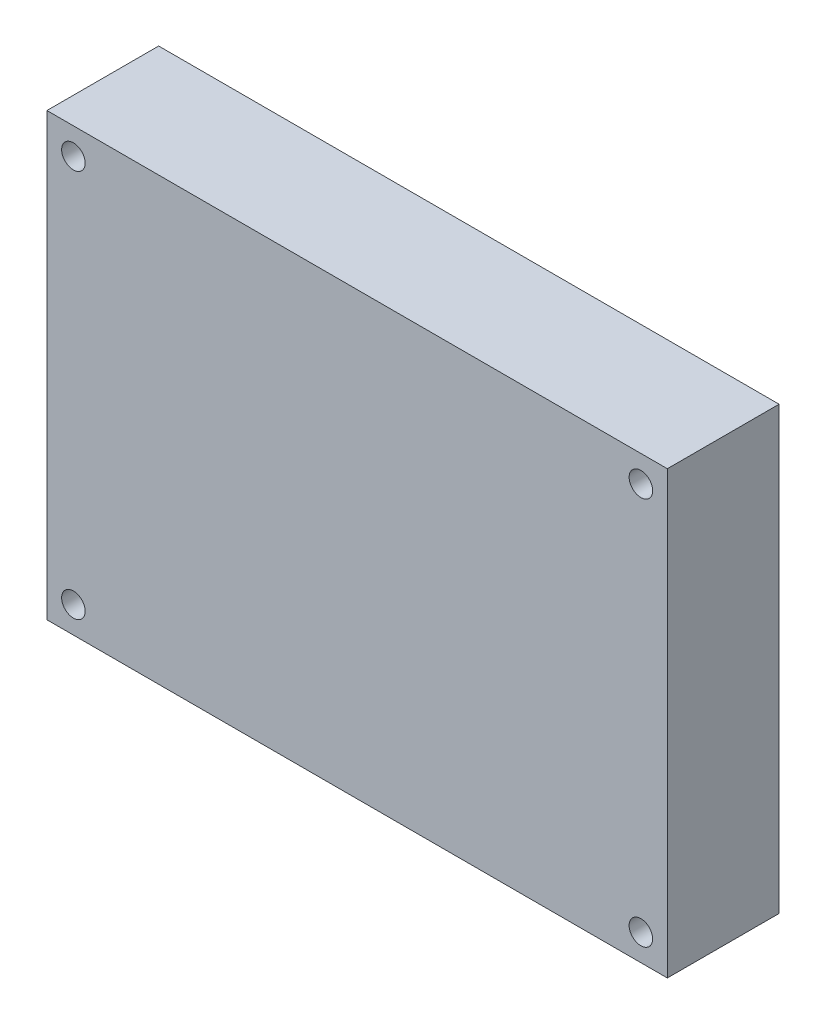
from build123d import *

# Parameters (mm, degrees)
ESQUISSE1_W               = 105.5
ESQUISSE1_H               = 75
BOSS_EXTRU_1_DEPTH        = 19
ESQUISSE2_R               = 2
ENL_V_MAT_EXTRU_1_DEPTH   = 68.452297959
SYM_TRIE2_COPY_1_SKETCH_R = 2
SYM_TRIE2_COPY_1_DEPTH    = 68.452297959


with BuildPart() as part:
    # Esquisse1 → Boss.-Extru.1 (new body)
    with BuildSketch(Plane.XY):
        Rectangle(ESQUISSE1_W, ESQUISSE1_H)
    extrude(amount=BOSS_EXTRU_1_DEPTH)

    # Esquisse2 → Enlèv. mat.-Extru.1 (cut, through all)
    with BuildSketch(Plane.XY.offset(19)):
        with Locations((-48.25, 33)):
            Circle(ESQUISSE2_R)
    enl_v_mat_extru_1 = extrude(amount=-ENL_V_MAT_EXTRU_1_DEPTH, mode=Mode.SUBTRACT)

    # Symétrie1: Enlèv. mat.-Extru.1 across plane
    add(enl_v_mat_extru_1.mirror(Plane.ZX), mode=Mode.SUBTRACT)

    # Symétrie2: Enlèv. mat.-Extru.1 across plane
    add(enl_v_mat_extru_1.mirror(Plane(origin=(0, 0, 0), x_dir=(0, 0, 1), z_dir=(1, 0, 0))), mode=Mode.SUBTRACT)

    # Symétrie2 copy 1 sketch → Symétrie2 copy 1 (cut, through all)
    with BuildSketch(Plane(origin=(0, 0, 19), x_dir=(-1, 0, 0), z_dir=(0, 0, 1))):
        with Locations((-48.25, 33)):
            Circle(SYM_TRIE2_COPY_1_SKETCH_R)
    extrude(amount=-SYM_TRIE2_COPY_1_DEPTH, mode=Mode.SUBTRACT)


solid = part.part
